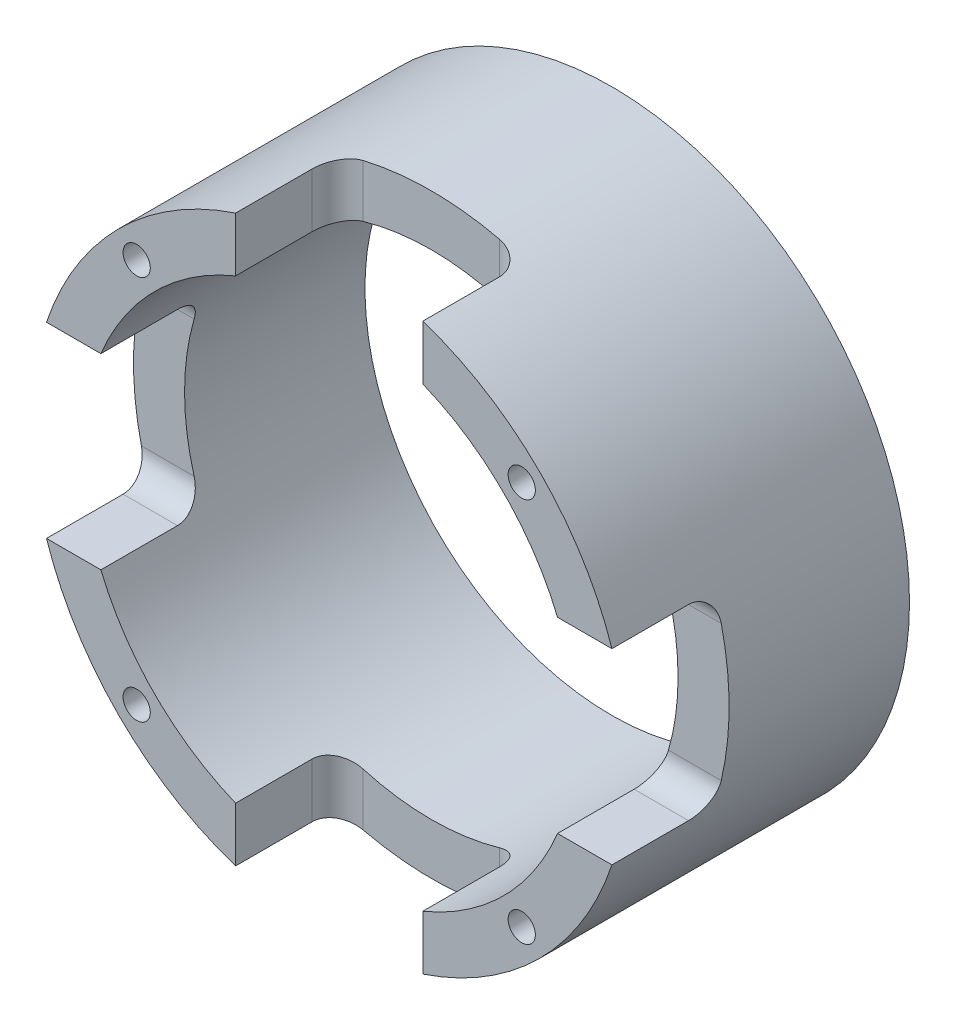
from build123d import *

# Parameters (mm, degrees)
SKETCH_1_R          = 35
SKETCH_1_R_2        = 29
SKETCH_1_R_3        = 1.6
EXTRUDE_1_DEPTH     = 33.2
SKETCH_3_W          = 22
SKETCH_3_H          = 23.089675748
SKETCH_3_W_2        = 23.089675748
SKETCH_3_H_2        = 22
CUT_EXTRUDE_1_DEPTH = 12
FILLET_1_R          = 3


with BuildPart() as part:
    # 草图1 → 凸台-拉伸1 (new body)
    with BuildSketch(Plane.XY):
        with Locations(Location((0, 0, 0), (0, 0, 180))):
            Circle(SKETCH_1_R)
        with Locations(Location((0, 0, 0), (0, 0, 180))):
            Circle(SKETCH_1_R_2, mode=Mode.SUBTRACT)
        with Locations(Location((-22.627416998, 22.627416998, 0), (0, 0, 180))):
            Circle(SKETCH_1_R_3, mode=Mode.SUBTRACT)
        with Locations(Location((22.627416998, 22.627416998, 0), (0, 0, 180))):
            Circle(SKETCH_1_R_3, mode=Mode.SUBTRACT)
        with Locations(Location((22.627416998, -22.627416998, 0), (0, 0, 180))):
            Circle(SKETCH_1_R_3, mode=Mode.SUBTRACT)
        with Locations(Location((-22.627416998, -22.627416998, 0), (0, 0, 180))):
            Circle(SKETCH_1_R_3, mode=Mode.SUBTRACT)
    extrude(amount=EXTRUDE_1_DEPTH)

    # 草图3 → 切除-拉伸1 (cut)
    with BuildSketch(Plane.XY.offset(33.2)):
        with Locations((0, 32.883523325)):
            Rectangle(SKETCH_3_W, SKETCH_3_H)
        with Locations((32.883523325, 0)):
            Rectangle(SKETCH_3_W_2, SKETCH_3_H_2)
        with Locations((0, -32.883523325)):
            Rectangle(SKETCH_3_W, SKETCH_3_H)
        with Locations((-32.883523325, 0)):
            Rectangle(SKETCH_3_W_2, SKETCH_3_H_2)
    extrude(amount=-CUT_EXTRUDE_1_DEPTH, mode=Mode.SUBTRACT)

    # 圆角1
    fillet_1_edges = [part.edges().sort_by_distance(p)[0] for p in [
        (-11, 30.029655591, 21.2),
        (11, 30.029655591, 21.2),
        (30.029655591, 11, 21.2),
        (30.029655591, -11, 21.2),
        (11, -30.029655591, 21.2),
        (-11, -30.029655591, 21.2),
        (-30.029655591, -11, 21.2),
        (-30.029655591, 11, 21.2),
    ]]
    fillet(fillet_1_edges, radius=FILLET_1_R)


solid = part.part
